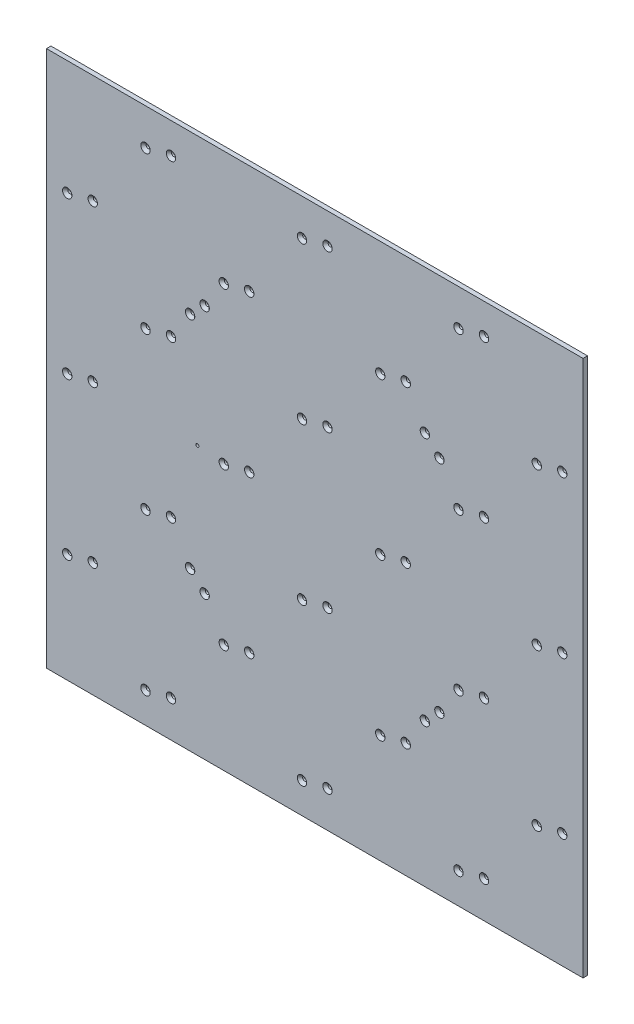
from build123d import *

# Parameters (mm, degrees)
BOSS_EXTRUDE1_START = 3
SKETCH1_W           = 1200
SKETCH1_H           = 1200
BOSS_EXTRUDE1_DEPTH = 10
SKETCH2_R           = 4.5
CUT_EXTRUDE1_DEPTH  = 849.587060943
CHAMFER1_SIZE       = 6
CUT_EXTRUDE2_REACH  = 850.587
SKETCH3_R           = 3.4


with BuildPart() as part:
    # Sketch1 → Boss-Extrude1 (new body)
    with BuildSketch(Plane.XY.offset(BOSS_EXTRUDE1_START)):
        Rectangle(SKETCH1_W, SKETCH1_H)
    extrude(amount=-BOSS_EXTRUDE1_DEPTH)

    # Sketch2 → Cut-Extrude1 (cut, through all)
    with BuildSketch(Plane(origin=(0, 0, -7), x_dir=(-1, 0, 0), z_dir=(0, 0, -1))):
        with Locations((246.236544033, -278.763455967)):
            Circle(SKETCH2_R)
        with Locations((278.763455967, -246.236544033)):
            Circle(SKETCH2_R)
        with Locations((-246.236544033, -278.763455967)):
            Circle(SKETCH2_R)
        with Locations((-278.763455967, -246.236544033)):
            Circle(SKETCH2_R)
        with Locations((-278.763455967, 246.236544033)):
            Circle(SKETCH2_R)
        with Locations((-246.236544033, 278.763455967)):
            Circle(SKETCH2_R)
        with Locations((278.763455967, 246.236544033)):
            Circle(SKETCH2_R)
        with Locations((246.236544033, 278.763455967)):
            Circle(SKETCH2_R)
        with Locations((378.500117834, -531.572378513)):
            Circle(SKETCH2_R)
        with Locations((321.50731127, -518.420192383)):
            Circle(SKETCH2_R)
        with Locations((553.501975109, -356.570521237)):
            Circle(SKETCH2_R)
        with Locations((496.509168546, -343.418335107)):
            Circle(SKETCH2_R)
        with Locations((28.496403282, -531.572378513)):
            Circle(SKETCH2_R)
        with Locations((-28.496403282, -518.420192383)):
            Circle(SKETCH2_R)
        with Locations((203.498260558, -356.570521237)):
            Circle(SKETCH2_R)
        with Locations((146.505453994, -343.418335107)):
            Circle(SKETCH2_R)
        with Locations((378.500117834, -181.568663962)):
            Circle(SKETCH2_R)
        with Locations((321.50731127, -168.416477832)):
            Circle(SKETCH2_R)
        with Locations((553.501975109, -6.566806686)):
            Circle(SKETCH2_R)
        with Locations((496.509168546, 6.585379444)):
            Circle(SKETCH2_R)
        with Locations((553.501975109, 343.436907866)):
            Circle(SKETCH2_R)
        with Locations((496.509168546, 356.589093996)):
            Circle(SKETCH2_R)
        with Locations((378.500117834, 518.438765142)):
            Circle(SKETCH2_R)
        with Locations((321.50731127, 531.590951272)):
            Circle(SKETCH2_R)
        with Locations((378.500117834, 168.43505059)):
            Circle(SKETCH2_R)
        with Locations((321.50731127, 181.58723672)):
            Circle(SKETCH2_R)
        with Locations((203.498260558, 343.436907866)):
            Circle(SKETCH2_R)
        with Locations((146.505453994, 356.589093996)):
            Circle(SKETCH2_R)
        with Locations((203.498260558, -6.566806686)):
            Circle(SKETCH2_R)
        with Locations((146.505453994, 6.585379444)):
            Circle(SKETCH2_R)
        with Locations((28.496403282, 168.43505059)):
            Circle(SKETCH2_R)
        with Locations((-28.496403282, 181.58723672)):
            Circle(SKETCH2_R)
        with Locations((28.496403282, -181.568663962)):
            Circle(SKETCH2_R)
        with Locations((-28.496403282, -168.416477832)):
            Circle(SKETCH2_R)
        with Locations((-146.505453994, -6.566806686)):
            Circle(SKETCH2_R)
        with Locations((-203.498260558, 6.585379444)):
            Circle(SKETCH2_R)
        with Locations((-146.505453994, -356.570521237)):
            Circle(SKETCH2_R)
        with Locations((-203.498260558, -343.418335107)):
            Circle(SKETCH2_R)
        with Locations((-321.50731127, -181.568663962)):
            Circle(SKETCH2_R)
        with Locations((-378.500117834, -168.416477832)):
            Circle(SKETCH2_R)
        with Locations((-553.501975109, -343.418335107)):
            Circle(SKETCH2_R)
        with Locations((-496.509168546, -356.570521237)):
            Circle(SKETCH2_R)
        with Locations((-378.500117834, -518.420192383)):
            Circle(SKETCH2_R)
        with Locations((-321.50731127, -531.572378513)):
            Circle(SKETCH2_R)
        with Locations((28.496403282, 518.438765142)):
            Circle(SKETCH2_R)
        with Locations((-28.496403282, 531.590951272)):
            Circle(SKETCH2_R)
        with Locations((-321.50731127, 518.438765142)):
            Circle(SKETCH2_R)
        with Locations((-378.500117834, 531.590951272)):
            Circle(SKETCH2_R)
        with Locations((-146.505453994, 343.436907866)):
            Circle(SKETCH2_R)
        with Locations((-203.498260558, 356.589093996)):
            Circle(SKETCH2_R)
        with Locations((-496.509168546, 343.436907866)):
            Circle(SKETCH2_R)
        with Locations((-553.501975109, 356.589093996)):
            Circle(SKETCH2_R)
        with Locations((-321.50731127, 168.43505059)):
            Circle(SKETCH2_R)
        with Locations((-378.500117834, 181.58723672)):
            Circle(SKETCH2_R)
        with Locations((-496.509168546, -6.566806686)):
            Circle(SKETCH2_R)
        with Locations((-553.501975109, 6.585379444)):
            Circle(SKETCH2_R)
    extrude(amount=-CUT_EXTRUDE1_DEPTH, mode=Mode.SUBTRACT)

    # Chamfer1
    chamfer1_edges = [part.edges().sort_by_distance(p)[0] for p in [
        (-549.001975109, 343.436907866, 3),
        (-492.009168546, 6.585379444, 3),
        (-549.001975109, -6.566806686, 3),
        (-317.00731127, -168.416477832, 3),
        (-142.005453994, 6.585379444, 3),
        (-23.996403282, 168.43505059, 3),
        (32.996403282, 181.58723672, 3),
        (-23.996403282, -181.568663962, 3),
        (-317.00731127, 181.58723672, 3),
        (-198.998260558, 343.436907866, 3),
        (-142.005453994, 356.589093996, 3),
        (-198.998260558, -6.566806686, 3),
        (250.736544033, 278.763455967, 3),
        (-274.263455967, 246.236544033, 3),
        (-241.736544033, 278.763455967, 3),
        (-374.000117834, -531.572378513, 3),
        (283.263455967, 246.236544033, 3),
        (283.263455967, -246.236544033, 3),
        (250.736544033, -278.763455967, 3),
        (-274.263455967, -246.236544033, 3),
        (-374.000117834, -181.568663962, 3),
        (-142.005453994, -343.418335107, 3),
        (-198.998260558, -356.570521237, 3),
        (32.996403282, -518.420192383, 3),
        (-317.00731127, -518.420192383, 3),
        (-549.001975109, -356.570521237, 3),
        (-492.009168546, -343.418335107, 3),
        (-23.996403282, -531.572378513, 3),
        (326.00731127, 168.43505059, 3),
        (558.001975109, 356.589093996, 3),
        (501.009168546, 343.436907866, 3),
        (207.998260558, 356.589093996, 3),
        (383.000117834, 181.58723672, 3),
        (501.009168546, -6.566806686, 3),
        (558.001975109, 6.585379444, 3),
        (558.001975109, -343.418335107, 3),
        (383.000117834, -168.416477832, 3),
        (326.00731127, -181.568663962, 3),
        (207.998260558, -343.418335107, 3),
        (32.996403282, -168.416477832, 3),
        (151.005453994, -6.566806686, 3),
        (207.998260558, 6.585379444, 3),
        (151.005453994, -356.570521237, 3),
        (32.996403282, 531.590951272, 3),
        (326.00731127, 518.438765142, 3),
        (383.000117834, 531.590951272, 3),
        (151.005453994, 343.436907866, 3),
        (-23.996403282, 518.438765142, 3),
        (326.00731127, -531.572378513, 3),
        (383.000117834, -518.420192383, 3),
        (501.009168546, -356.570521237, 3),
        (-241.736544033, -278.763455967, 3),
        (-492.009168546, 356.589093996, 3),
        (-374.000117834, 518.438765142, 3),
        (-317.00731127, 531.590951272, 3),
        (-374.000117834, 168.43505059, 3),
    ]]
    chamfer(chamfer1_edges, length=CHAMFER1_SIZE)

    # Sketch3 → Cut-Extrude2 (cut, up to next)
    with BuildSketch(Plane.XY.offset(3), mode=Mode.PRIVATE) as cut_extrude2_sk1:
        with Locations((-262.5, 0)):
            Circle(SKETCH3_R)
    cut_extrude2_tool1 = extrude(cut_extrude2_sk1.sketch, amount=-CUT_EXTRUDE2_REACH, mode=Mode.PRIVATE) & part.part
    add(cut_extrude2_tool1.solids().sort_by_distance((-262.5, 0, 3))[0], mode=Mode.SUBTRACT)


solid = part.part
